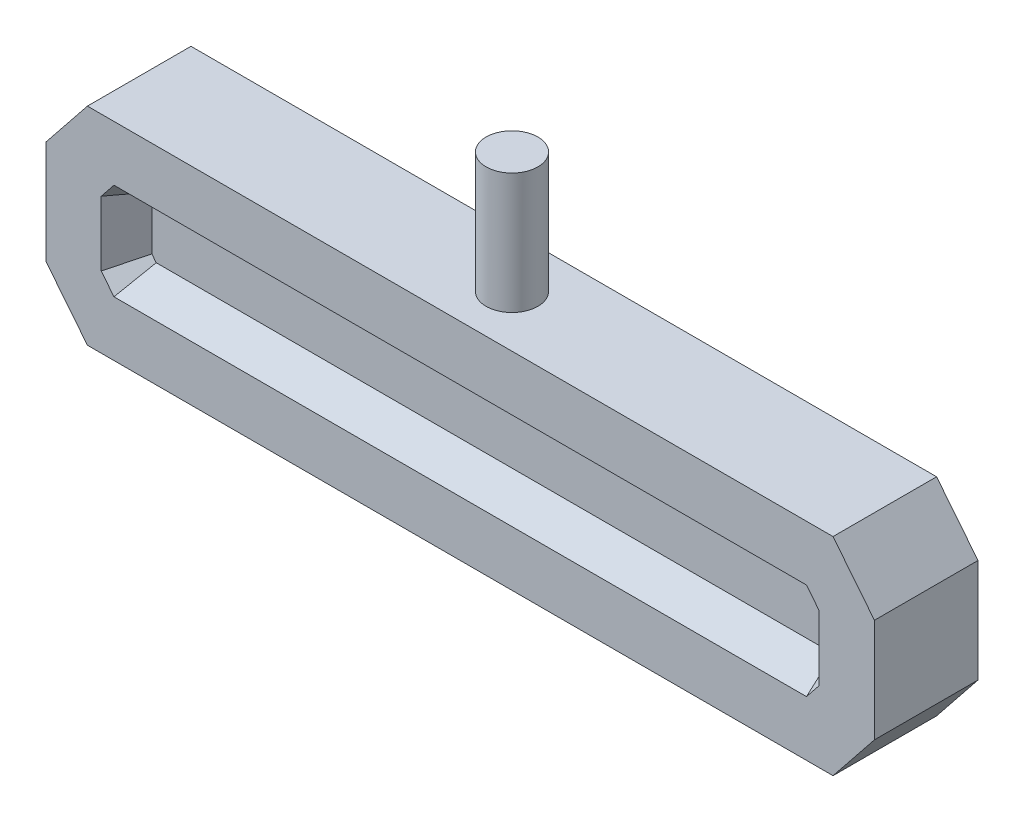
from build123d import *

# Parameters (mm, degrees)
BOSS_EXTRUDE1_DEPTH = 19.05
CUT_EXTRUDE1_DEPTH  = 12.7
CUT_EXTRUDE1_TAPER  = 25
SKETCH9_R           = 9.525
BOSS_EXTRUDE3_DEPTH = 44.45


with BuildPart() as part:
    # Sketch2 → Boss-Extrude1 (new, symmetric)
    with BuildSketch(Plane.XY):
        Polygon((-137.16, 76.2), (137.16, 76.2), (152.4, 57.15), (152.4, 19.05), (137.16, 0), (-137.16, 0), (-152.4, 19.05), (-152.4, 57.15), align=None)
    extrude(amount=BOSS_EXTRUDE1_DEPTH, both=True)

    # 3DSketch1 → Cut-Extrude1 (cut)
    with BuildSketch(Plane(origin=(127.393703099, 20.32, 19.05), x_dir=(-0.9935119261035652, 0.11372797672509682, 0), z_dir=(0, 0, -1))):
        Polygon((0, 0), (253.134326679, -28.976456202), (258.45642237, -23.689554441), (261.16818156, 0), (257.178493531, 6.35282789), (4.044166852, 35.329284092), (-1.277928839, 30.042382332), (-3.989688029, 6.35282789), align=None)
    extrude(amount=CUT_EXTRUDE1_DEPTH, taper=CUT_EXTRUDE1_TAPER, mode=Mode.SUBTRACT)

    # Sketch9 → Boss-Extrude3 (add)
    with BuildSketch(Plane(origin=(0, 76.2, 0), x_dir=(1, 0, 0), z_dir=(0, 1, 0))):
        with Locations(Location((0, 0, 0), (0, 0, 90))):
            Circle(SKETCH9_R)
    extrude(amount=BOSS_EXTRUDE3_DEPTH)


solid = part.part
